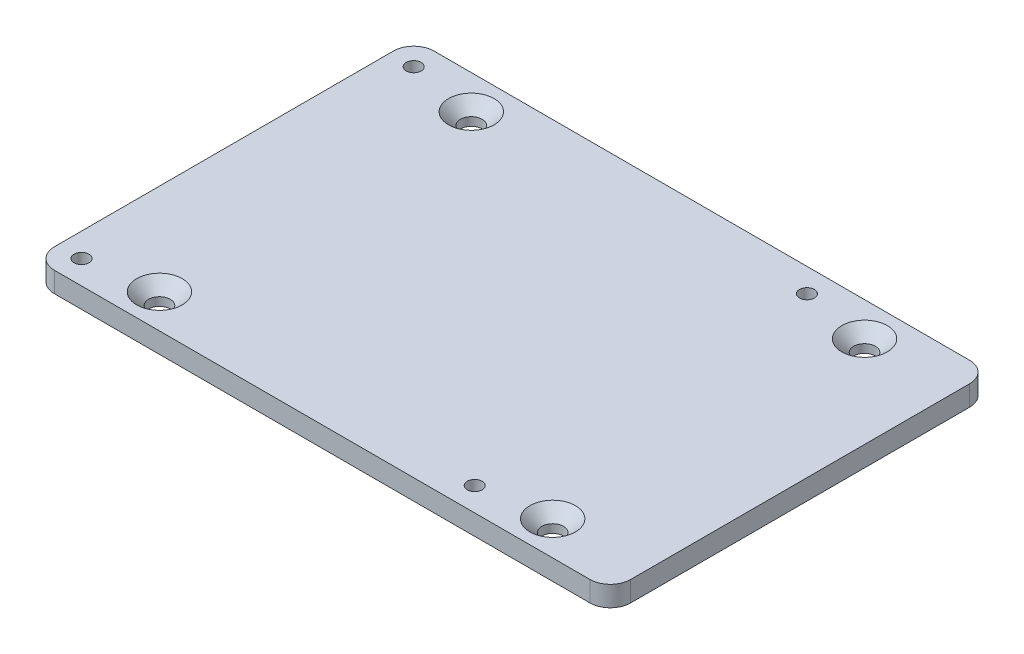
from build123d import *

# Parameters (mm, degrees)
SKETCH1_W                    = 85
SKETCH1_H                    = 56
BOSS_EXTRUDE1_DEPTH          = 3
M2_CLEARANCE_HOLE1_D         = 2.2
M2_CLEARANCE_HOLE1_DEPTH     = 5
M2_CLEARANCE_HOLE1_TIP       = 0.660946681
FILLET1_R                    = 3
CSK_FOR_M3_SFHCS1_AT_2_COUNT = 2
CSK_FOR_M3_SFHCS1_AT_2_PITCH = 74.027022093
CSK_FOR_M3_SFHCS1_AT_3_COUNT = 2
CSK_FOR_M3_SFHCS1_AT_3_PITCH = 46
CSK_FOR_M3_SFHCS1_AT_4_COUNT = 2
CSK_FOR_M3_SFHCS1_AT_4_PITCH = 58


with BuildPart() as part:
    # Sketch1 → Boss-Extrude1 (new body)
    with BuildSketch(Plane(origin=(0, 0, 0), x_dir=(1, 0, 0), z_dir=(0, 1, 0))):
        Rectangle(SKETCH1_W, SKETCH1_H)
    extrude(amount=BOSS_EXTRUDE1_DEPTH)

    # M2 Clearance Hole1
    with Locations(Plane(origin=(0, 3, 0), x_dir=(1, 0, 0), z_dir=(0, 1, 0))):
        with Locations((-39, 24.5), (19, -24.5), (19, 24.5), (-39, -24.5)):
            Hole(M2_CLEARANCE_HOLE1_D / 2, depth=M2_CLEARANCE_HOLE1_DEPTH)
            with Locations((0, 0, -(M2_CLEARANCE_HOLE1_DEPTH + M2_CLEARANCE_HOLE1_TIP / 2))):  # 118° drill point
                Cone(0, M2_CLEARANCE_HOLE1_D / 2, M2_CLEARANCE_HOLE1_TIP, mode=Mode.SUBTRACT)

    # Fillet1
    fillet1_edges = [part.edges().sort_by_distance(p)[0] for p in [
        (-42.5, 1.5, -28),
        (42.5, 1.5, -28),
        (42.5, 1.5, 28),
        (-42.5, 1.5, 28),
    ]]
    fillet(fillet1_edges, radius=FILLET1_R)

    # Sketch6 → CSK for M3 SFHCS1 (revolve, cut)
    with BuildSketch(Plane(origin=(-29, 3, -23), x_dir=(0, 0, 1), z_dir=(1, 0, 0))):
        Polygon((0, 0), (0, 3), (1.6, 3), (1.6, 1.76), (3.36, 0), align=None)
    csk_for_m3_sfhcs1 = revolve(axis=Axis((-29, 9.35, -23), (0, -1, 0)), mode=Mode.SUBTRACT)

    # CSK for M3 SFHCS1 at 2: CSK for M3 SFHCS1 ×2
    with Locations(*[Vector(0.7834976790895338, 0, 0.621394711002044) * (i * CSK_FOR_M3_SFHCS1_AT_2_PITCH) for i in range(1, CSK_FOR_M3_SFHCS1_AT_2_COUNT)]):
        add(csk_for_m3_sfhcs1, mode=Mode.SUBTRACT)

    # CSK for M3 SFHCS1 at 3: CSK for M3 SFHCS1 ×2
    with Locations(*[(0, 0, i * CSK_FOR_M3_SFHCS1_AT_3_PITCH) for i in range(1, CSK_FOR_M3_SFHCS1_AT_3_COUNT)]):
        add(csk_for_m3_sfhcs1, mode=Mode.SUBTRACT)

    # CSK for M3 SFHCS1 at 4: CSK for M3 SFHCS1 ×2
    with Locations(*[(i * CSK_FOR_M3_SFHCS1_AT_4_PITCH, 0, 0) for i in range(1, CSK_FOR_M3_SFHCS1_AT_4_COUNT)]):
        add(csk_for_m3_sfhcs1, mode=Mode.SUBTRACT)


solid = part.part
